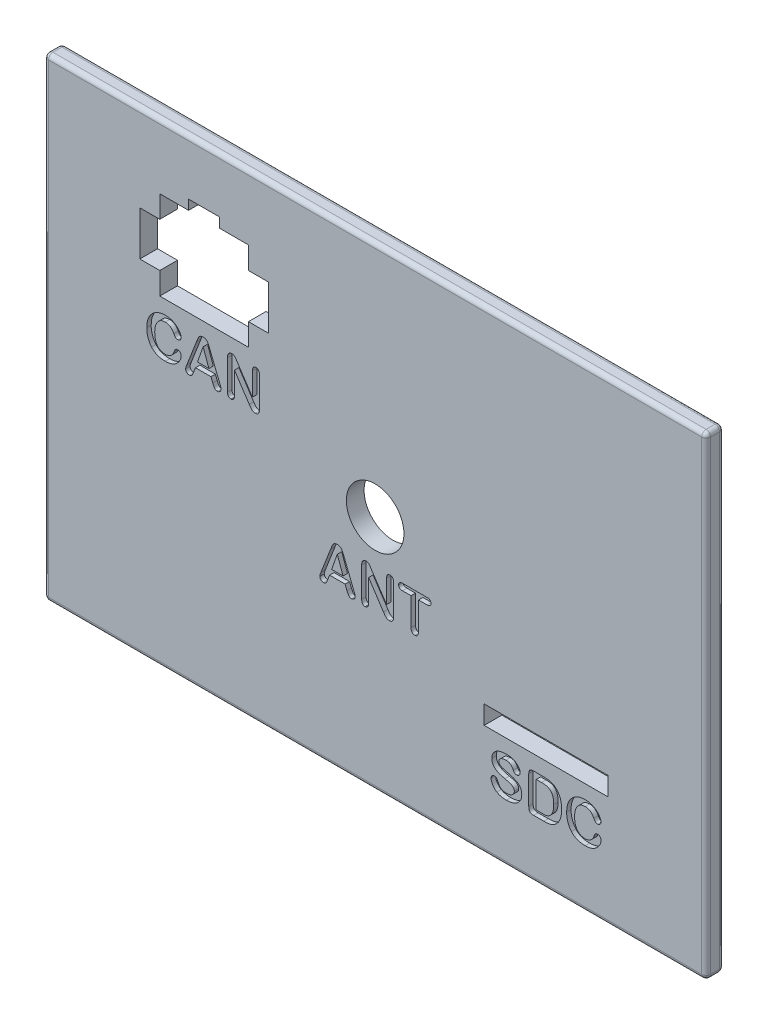
from build123d import *

# Parameters (mm, degrees)
SKETCH1_W           = 74.7
SKETCH1_H           = 53.5
BOSS_EXTRUDE1_DEPTH = 2
SKETCH5_W           = 14
SKETCH5_H           = 2.1
SKETCH5_R           = 3.25
CUT_EXTRUDE1_DEPTH  = 46.984616993
FILLET1_R           = 0.5
CUT_EXTRUDE2_DEPTH  = 0.5


with BuildPart() as part:
    # Sketch1 → Boss-Extrude1 (new body)
    with BuildSketch(Plane.XY):
        Rectangle(SKETCH1_W, SKETCH1_H)
    extrude(amount=BOSS_EXTRUDE1_DEPTH)

    # Sketch5 → Cut-Extrude1 (cut, through all)
    with BuildSketch(Plane.XY.offset(2)):
        Polygon((-24.3, 9.45), (-14.3, 9.45), (-14.3, 11.95), (-12.05, 11.95), (-12.05, 16.95), (-14.3, 16.95), (-14.3, 19.45), (-17.55, 19.45), (-17.55, 20.55), (-21.05, 20.55), (-21.05, 19.45), (-24.3, 19.45), (-24.3, 16.95), (-26.55, 16.95), (-26.55, 11.95), (-24.3, 11.95), align=None)
        with Locations((19.3, -13.15)):
            Rectangle(SKETCH5_W, SKETCH5_H)
        Circle(SKETCH5_R)
    extrude(amount=-CUT_EXTRUDE1_DEPTH, mode=Mode.SUBTRACT)

    # Fillet1
    fillet1_edges = [part.edges().sort_by_distance(p)[0] for p in [
        (-37.35, 0, 2),
        (0, -26.75, 2),
        (37.35, 0, 2),
        (0, -26.75, 0),
        (-37.35, 0, 0),
        (0, 26.75, 0),
        (37.35, 0, 0),
        (37.35, -26.75, 1),
        (-37.35, -26.75, 1),
        (-37.35, 26.75, 1),
        (37.35, 26.75, 1),
        (0, 26.75, 2),
    ]]
    fillet(fillet1_edges, radius=FILLET1_R)

    # Sketch6 → Cut-Extrude2 (cut)
    # profile 1 of 9: a face of its own
    with BuildSketch(Plane.XY.offset(2)):
        with BuildLine():
            add(Edge.make_bspline(
                [(-21.884863281, 4.829003906), (-21.886057094, 4.794056647), (-21.888521988, 4.721900184), (-21.909251985, 4.612138484), (-21.940999769, 4.4979383), (-21.986141413, 4.380626314), (-22.04347078, 4.260966163), (-22.117789191, 4.142674879), (-22.205741004, 4.024922581), (-22.308131844, 3.909172422), (-22.425142436, 3.799296943), (-22.558880555, 3.70001768), (-22.7074398, 3.611752476), (-22.870628097, 3.534000083), (-23.04834912, 3.470069416), (-23.241628866, 3.426127215), (-23.448496536, 3.398183798), (-23.591311619, 3.395254315), (-23.664648437, 3.39375)],
                knots=[0, 0, 0, 0, 0.663733519, 1.370426865, 2.116139696, 2.914458905, 3.756161797, 4.633801399, 5.564768272, 6.546895284, 7.567232022, 8.609557965, 9.705783212, 10.846455846, 12.040496113, 13.287086875, 14.606894913, 16, 16, 16, 16], degree=3))
            add(Edge.make_bspline(
                [(-23.664648437, 3.39375), (-23.720633584, 3.394220413), (-23.830111703, 3.395140298), (-23.990512826, 3.408316902), (-24.143458118, 3.427047622), (-24.288935404, 3.4539833), (-24.427215986, 3.490363338), (-24.558752709, 3.535097578), (-24.684584073, 3.587752841), (-24.803684244, 3.650392758), (-24.917215534, 3.723378242), (-25.02589883, 3.805960696), (-25.130850828, 3.898540442), (-25.194819294, 3.967678912), (-25.22734375, 4.002832031)],
                knots=[0, 0, 0, 0, 1.162398207, 2.273052359, 3.340187725, 4.361698781, 5.343118899, 6.307107414, 7.245071305, 8.173155143, 9.098082292, 10.044846171, 11.00591152, 12, 12, 12, 12], degree=3))
            add(Edge.make_bspline(
                [(-25.22734375, 4.002832031), (-25.255589202, 4.037961763), (-25.312203364, 4.108374526), (-25.390111059, 4.220431962), (-25.459570948, 4.339625624), (-25.525586162, 4.463165003), (-25.581949018, 4.59346772), (-25.632224116, 4.727698528), (-25.674782061, 4.8664731), (-25.708473465, 5.009876978), (-25.736424734, 5.157270667), (-25.753765904, 5.309472076), (-25.767342079, 5.465382026), (-25.768277671, 5.571062029), (-25.76875, 5.624414063)],
                knots=[0, 0, 0, 0, 0.929575355, 1.863207229, 2.811429804, 3.773642551, 4.750392879, 5.73698116, 6.729013264, 7.741753443, 8.774044155, 9.821085133, 10.899985467, 12, 12, 12, 12], degree=3))
            add(Edge.make_bspline(
                [(-25.76875, 5.624414063), (-25.767022042, 5.710346034), (-25.763650091, 5.878034327), (-25.733677911, 6.122292947), (-25.687204443, 6.353287685), (-25.61920174, 6.569753674), (-25.533543274, 6.772089928), (-25.432122567, 6.960042108), (-25.31205981, 7.131944178), (-25.17690159, 7.288413214), (-25.027071962, 7.428456039), (-24.864894257, 7.551237913), (-24.69032629, 7.655594309), (-24.50468213, 7.741721519), (-24.309794446, 7.808757789), (-24.108202317, 7.858759114), (-23.900190329, 7.888201346), (-23.759368931, 7.891890331), (-23.688378906, 7.89375)],
                knots=[0, 0, 0, 0, 1.192086909, 2.32624733, 3.409866705, 4.457877143, 5.469000883, 6.455088314, 7.416011801, 8.372962001, 9.319325461, 10.256879636, 11.190511563, 12.136385829, 13.091719595, 14.046248446, 15.015086683, 16, 16, 16, 16], degree=3))
            add(Edge.make_bspline(
                [(-23.688378906, 7.89375), (-23.645003752, 7.893007028), (-23.559318242, 7.891539323), (-23.432515128, 7.881915766), (-23.309329029, 7.865069093), (-23.18962754, 7.842203116), (-23.073486544, 7.81360166), (-22.961155614, 7.777107858), (-22.852492222, 7.73434287), (-22.748142159, 7.684754146), (-22.648249581, 7.631631766), (-22.554325717, 7.574310691), (-22.465908852, 7.51471716), (-22.383987666, 7.450989428), (-22.307560025, 7.384790368), (-22.238025477, 7.314607981), (-22.173223803, 7.242787511), (-22.115985293, 7.167221169), (-22.064054215, 7.091577958), (-22.020088471, 7.015425459), (-21.982453281, 6.940812009), (-21.949781653, 6.867702097), (-21.926381176, 6.794765325), (-21.909665685, 6.723015211), (-21.898331455, 6.652506058), (-21.896964752, 6.605608004), (-21.896289062, 6.582421875)],
                knots=[0, 0, 0, 0, 1.284700242, 2.537862918, 3.763812693, 4.965289083, 6.145935712, 7.303948861, 8.460888676, 9.602102237, 10.724019168, 11.810373379, 12.859709494, 13.88027226, 14.88267171, 15.852117704, 16.804758353, 17.745428632, 18.657571087, 19.520770973, 20.347343408, 21.132381758, 21.889741149, 22.611674871, 23.313620019, 24, 24, 24, 24], degree=3))
            add(Edge.make_bspline(
                [(-21.896289062, 6.582421875), (-21.897767281, 6.557996548), (-21.90068221, 6.50983176), (-21.920243348, 6.4393334), (-21.955923928, 6.37484715), (-22.001706231, 6.315572385), (-22.057244589, 6.265686386), (-22.119918757, 6.228859237), (-22.188509753, 6.205350026), (-22.23652906, 6.203036268), (-22.261035156, 6.201855469)],
                knots=[0, 0, 0, 0, 1.005202555, 1.982178884, 2.979908251, 4.019228851, 5.052378826, 6.030321538, 6.994797445, 8, 8, 8, 8], degree=3))
            add(Edge.make_bspline(
                [(-22.261035156, 6.201855469), (-22.287468978, 6.20285214), (-22.337584401, 6.20474171), (-22.407805062, 6.21909527), (-22.467501456, 6.244770194), (-22.518128566, 6.282271408), (-22.561601116, 6.334044744), (-22.606992997, 6.397456194), (-22.65543894, 6.475270009), (-22.686481302, 6.533007997), (-22.703125, 6.563964844)],
                knots=[0, 0, 0, 0, 1.03602979, 1.964190893, 2.792215287, 3.564084538, 4.410155262, 5.430272824, 6.62221301, 8, 8, 8, 8], degree=3))
            add(Edge.make_bspline(
                [(-22.703125, 6.563964844), (-22.731926771, 6.615897548), (-22.787491163, 6.716086151), (-22.885493382, 6.850529495), (-22.991253205, 6.964140596), (-23.105268161, 7.057979495), (-23.231006748, 7.130638726), (-23.36941063, 7.183014306), (-23.521893789, 7.212686063), (-23.627606269, 7.216684209), (-23.682226562, 7.21875)],
                knots=[0, 0, 0, 0, 1.14083101, 2.200891824, 3.189077095, 4.117958574, 5.028926365, 5.968284059, 6.950238216, 8, 8, 8, 8], degree=3))
            add(Edge.make_bspline(
                [(-23.682226562, 7.21875), (-23.726263025, 7.217784627), (-23.812774236, 7.215888118), (-23.938779062, 7.194561528), (-24.058251271, 7.162819439), (-24.170408387, 7.116003457), (-24.276195656, 7.057453795), (-24.374553512, 6.984422619), (-24.465486212, 6.898163539), (-24.549908855, 6.799837239), (-24.625411416, 6.689031813), (-24.690338774, 6.566759379), (-24.746267554, 6.434266868), (-24.790199163, 6.28999193), (-24.827002622, 6.135190356), (-24.850399539, 5.968639636), (-24.865797119, 5.791697286), (-24.867747887, 5.670152559), (-24.86875, 5.607714844)],
                knots=[0, 0, 0, 0, 0.93671651, 1.840213212, 2.713397844, 3.56368846, 4.421020421, 5.281885359, 6.164466969, 7.084649485, 8.036264718, 9.013062724, 10.027939462, 11.093339593, 12.220621858, 13.412469407, 14.670781518, 16, 16, 16, 16], degree=3))
            add(Edge.make_bspline(
                [(-24.86875, 5.607714844), (-24.868104662, 5.565522112), (-24.866844688, 5.483144039), (-24.861059512, 5.361998662), (-24.849643473, 5.246458871), (-24.833518903, 5.136302738), (-24.814810002, 5.031353093), (-24.790138351, 4.932207533), (-24.760842839, 4.838398858), (-24.728073625, 4.749746011), (-24.689373356, 4.667052477), (-24.649775391, 4.588508883), (-24.604901548, 4.516060592), (-24.554911648, 4.450321624), (-24.50339892, 4.388050164), (-24.447156278, 4.331915422), (-24.386975807, 4.281590958), (-24.302463413, 4.221690769), (-24.187976905, 4.159910726), (-24.039275347, 4.106820458), (-23.879328455, 4.074371681), (-23.76880766, 4.07065612), (-23.712109375, 4.06875)],
                knots=[0, 0, 0, 0, 1.161576005, 2.267888061, 3.337585273, 4.356077319, 5.33204537, 6.270922222, 7.166254778, 8.036538097, 8.870177389, 9.678142996, 10.45692397, 11.2117863, 11.950096439, 12.68003429, 13.395618977, 14.107193223, 15.528992878, 16.960094082, 18.440497528, 20, 20, 20, 20], degree=3))
            add(Edge.make_bspline(
                [(-23.712109375, 4.06875), (-23.681022975, 4.06907424), (-23.619861844, 4.069712167), (-23.530373804, 4.080132678), (-23.444208213, 4.094702677), (-23.362052277, 4.115977523), (-23.282874008, 4.141955875), (-23.208333352, 4.175938566), (-23.136646175, 4.214501763), (-23.068811019, 4.259293398), (-23.005467551, 4.310752319), (-22.945641852, 4.367230051), (-22.888831564, 4.428452804), (-22.838242134, 4.496953233), (-22.790359926, 4.570143188), (-22.746662298, 4.649176094), (-22.706818005, 4.733671793), (-22.684555949, 4.792801404), (-22.673242187, 4.822851563)],
                knots=[0, 0, 0, 0, 1.080453892, 2.125745732, 3.129130718, 4.117609764, 5.07455133, 6.023212249, 6.962414916, 7.903439618, 8.845456672, 9.796903999, 10.763291339, 11.745501622, 12.754406698, 13.803416246, 14.883677954, 16, 16, 16, 16], degree=3))
            add(Edge.make_bspline(
                [(-22.673242187, 4.822851563), (-22.663703569, 4.850842061), (-22.645276697, 4.904914599), (-22.611863559, 4.980382063), (-22.575565365, 5.047738311), (-22.536835856, 5.108359409), (-22.487569466, 5.158842677), (-22.424857479, 5.194819144), (-22.349517365, 5.214701973), (-22.295725594, 5.217091606), (-22.2671875, 5.218359375)],
                knots=[0, 0, 0, 0, 1.148264852, 2.218238262, 3.200956292, 4.119438462, 5.004604087, 5.912235567, 6.892380428, 8, 8, 8, 8], degree=3))
            add(Edge.make_bspline(
                [(-22.2671875, 5.218359375), (-22.241821072, 5.217098618), (-22.191924892, 5.214618688), (-22.120426214, 5.192157659), (-22.053705739, 5.157815352), (-21.995969044, 5.10810378), (-21.946221447, 5.050011615), (-21.910495, 4.982532384), (-21.888548228, 4.90799325), (-21.886114194, 4.855818083), (-21.884863281, 4.829003906)],
                knots=[0, 0, 0, 0, 1.000050397, 1.967115494, 2.935635085, 3.946684534, 4.957733984, 5.941906876, 6.942292355, 8, 8, 8, 8], degree=3))
        make_face()
    # profile 2 of 9: a face of its own
    with BuildSketch(Plane.XY.offset(2)):
        with BuildLine():
            Line((-18.318261719, 3.937792969), (-18.523925781, 4.4625))
            Line((-18.523925781, 4.4625), (-20.273828125, 4.4625))
            Line((-20.273828125, 4.4625), (-20.479492187, 3.926367188))
            add(Edge.make_bspline(
                [(-20.479492187, 3.926367188), (-20.498376972, 3.878135809), (-20.532989727, 3.789735492), (-20.586637938, 3.6711749), (-20.635266147, 3.577743801), (-20.680358927, 3.505181662), (-20.732955909, 3.451682631), (-20.79890901, 3.417407614), (-20.877623411, 3.397221147), (-20.934337272, 3.394959014), (-20.964648437, 3.39375)],
                knots=[0, 0, 0, 0, 1.589179946, 2.912709847, 3.990397165, 4.820646782, 5.526248733, 6.26234321, 7.071295771, 8, 8, 8, 8], degree=3))
            add(Edge.make_bspline(
                [(-20.964648437, 3.39375), (-20.991484232, 3.395262301), (-21.0444056, 3.398244626), (-21.120899626, 3.422454537), (-21.19231069, 3.461062984), (-21.257095381, 3.513249339), (-21.311808059, 3.574874809), (-21.351455872, 3.643388569), (-21.37688319, 3.716017689), (-21.379788265, 3.766495709), (-21.38125, 3.791894531)],
                knots=[0, 0, 0, 0, 1.012468346, 1.996632184, 3.002236258, 4.065667855, 5.124941345, 6.097262832, 7.042607408, 8, 8, 8, 8], degree=3))
            add(Edge.make_bspline(
                [(-21.38125, 3.791894531), (-21.379895267, 3.822194033), (-21.377112393, 3.884434857), (-21.357317278, 3.962920807), (-21.333550876, 4.030778076), (-21.311591688, 4.092320019), (-21.285509161, 4.163445828), (-21.265379663, 4.213532328), (-21.2546875, 4.240136719)],
                knots=[0, 0, 0, 0, 1.162779838, 2.388566498, 3.08974091, 3.926345762, 4.898539362, 6, 6, 6, 6], degree=3))
            Line((-21.2546875, 4.240136719), (-20.153417969, 7.065820313))
            add(Edge.make_bspline(
                [(-20.153417969, 7.065820313), (-20.145274887, 7.08723032), (-20.128293111, 7.131879261), (-20.100389852, 7.201530891), (-20.072066956, 7.277787601), (-20.040915906, 7.357839328), (-20.009217195, 7.43801458), (-19.973527337, 7.512291673), (-19.939090224, 7.580482934), (-19.901702654, 7.641202668), (-19.860972235, 7.696029302), (-19.81429663, 7.744454058), (-19.761399025, 7.78694623), (-19.703485949, 7.825357385), (-19.638209904, 7.856168949), (-19.565736114, 7.878258938), (-19.48622394, 7.891450714), (-19.430716207, 7.892965214), (-19.401953125, 7.89375)],
                knots=[0, 0, 0, 0, 0.906149852, 1.889706515, 2.96811083, 4.12389095, 5.288239382, 6.376994434, 7.382631969, 8.308939681, 9.194397083, 10.07962691, 10.961131357, 11.874074475, 12.822804478, 13.805267996, 14.862730428, 16, 16, 16, 16], degree=3))
            add(Edge.make_bspline(
                [(-19.401953125, 7.89375), (-19.37289357, 7.892973189), (-19.316796718, 7.891473626), (-19.236469415, 7.87816451), (-19.163448352, 7.856626271), (-19.098749133, 7.824974429), (-19.040419921, 7.787680483), (-18.987342008, 7.745871934), (-18.941172971, 7.697547658), (-18.887689333, 7.62667168), (-18.830149592, 7.530619993), (-18.782010251, 7.426959881), (-18.747104715, 7.335729029), (-18.714456311, 7.257551118), (-18.680876221, 7.167801546), (-18.65695226, 7.104484207), (-18.644335937, 7.07109375)],
                knots=[0, 0, 0, 0, 1.005463131, 1.940955953, 2.810500616, 3.631666672, 4.42517864, 5.204561669, 5.964968357, 6.731842121, 8.274852444, 9.831306624, 10.68267648, 11.656482744, 12.764143998, 14, 14, 14, 14], degree=3))
            Line((-18.644335937, 7.07109375), (-17.519335937, 4.263867188))
            add(Edge.make_bspline(
                [(-17.519335937, 4.263867188), (-17.509051891, 4.238101267), (-17.489248349, 4.188484952), (-17.46123927, 4.116856335), (-17.440356629, 4.049673329), (-17.419584672, 3.989107225), (-17.406322542, 3.932986755), (-17.39531352, 3.883018021), (-17.388509812, 3.838374046), (-17.38782357, 3.810371487), (-17.3875, 3.797167969)],
                knots=[0, 0, 0, 0, 1.36622511, 2.630880465, 3.785062113, 4.829837655, 5.781525877, 6.621841003, 7.350182692, 8, 8, 8, 8], degree=3))
            add(Edge.make_bspline(
                [(-17.3875, 3.797167969), (-17.389116357, 3.772400862), (-17.392360355, 3.722693739), (-17.416126348, 3.649748921), (-17.457387743, 3.58148613), (-17.510848053, 3.517478192), (-17.575174711, 3.462590611), (-17.648793647, 3.422702714), (-17.728718026, 3.398117503), (-17.784592612, 3.395218312), (-17.812890625, 3.39375)],
                knots=[0, 0, 0, 0, 0.918533131, 1.843478885, 2.81316186, 3.862812883, 4.927781559, 5.930017069, 6.951644948, 8, 8, 8, 8], degree=3))
            add(Edge.make_bspline(
                [(-17.812890625, 3.39375), (-17.845034362, 3.395162388), (-17.905595251, 3.397823419), (-17.989339934, 3.424845041), (-18.057967588, 3.468994625), (-18.106479273, 3.516208089), (-18.139853484, 3.563293528), (-18.166111354, 3.606545489), (-18.193242823, 3.657674666), (-18.229373196, 3.734156918), (-18.270040922, 3.828886456), (-18.302966904, 3.903249679), (-18.318261719, 3.937792969)],
                knots=[0, 0, 0, 0, 1.202315025, 2.265239587, 3.252603888, 4.239051274, 4.781746036, 5.412840692, 6.135219166, 6.950797606, 8.583580985, 10, 10, 10, 10], degree=3))
        make_face()
        Polygon((-20.0453125, 5.1375), (-18.75859375, 5.1375), (-19.408105469, 6.9375), align=None, mode=Mode.SUBTRACT)
    # profile 3 of 9: a face of its own
    with BuildSketch(Plane.XY.offset(2)):
        with BuildLine():
            Line((-15.554101562, 7.365527344), (-13.84375, 4.8))
            Line((-13.84375, 4.8), (-13.84375, 7.389257813))
            add(Edge.make_bspline(
                [(-13.84375, 7.389257813), (-13.84242962, 7.428890836), (-13.839956489, 7.503125255), (-13.821168096, 7.60720892), (-13.788246847, 7.695501131), (-13.741595069, 7.768006788), (-13.683592782, 7.824715656), (-13.615107199, 7.865002193), (-13.537485329, 7.889691024), (-13.482706336, 7.892366972), (-13.454394531, 7.89375)],
                knots=[0, 0, 0, 0, 1.319117216, 2.470765316, 3.505116792, 4.43580569, 5.318756254, 6.18027265, 7.059497782, 8, 8, 8, 8], degree=3))
            add(Edge.make_bspline(
                [(-13.454394531, 7.89375), (-13.425221306, 7.892341002), (-13.3687539, 7.889613758), (-13.288898563, 7.86542748), (-13.219104722, 7.824722793), (-13.160184578, 7.768090007), (-13.112682383, 7.695581862), (-13.07860514, 7.607397588), (-13.060118507, 7.503099712), (-13.057596483, 7.428881946), (-13.05625, 7.389257813)],
                knots=[0, 0, 0, 0, 0.959871134, 1.857917088, 2.719075999, 3.600089629, 4.526699118, 5.554128738, 6.694173474, 8, 8, 8, 8], degree=3))
            Line((-13.05625, 7.389257813), (-13.05625, 3.966796875))
            add(Edge.make_bspline(
                [(-13.05625, 3.966796875), (-13.05733574, 3.921872847), (-13.059373547, 3.837555646), (-13.081084085, 3.719658122), (-13.117697373, 3.61930552), (-13.168924925, 3.536042144), (-13.236347834, 3.470717175), (-13.319699284, 3.425816133), (-13.41688116, 3.39777233), (-13.486414404, 3.395135479), (-13.522949219, 3.39375)],
                knots=[0, 0, 0, 0, 1.276164049, 2.395212213, 3.391561633, 4.297456637, 5.151673506, 6.027862746, 6.963780962, 8, 8, 8, 8], degree=3))
            add(Edge.make_bspline(
                [(-13.522949219, 3.39375), (-13.559989822, 3.395487935), (-13.631431233, 3.398839948), (-13.734350002, 3.423312633), (-13.827926122, 3.468969046), (-13.912006085, 3.534985389), (-13.990718291, 3.61505205), (-14.062766795, 3.707921797), (-14.130646785, 3.808537853), (-14.177105113, 3.876299164), (-14.200585937, 3.910546875)],
                knots=[0, 0, 0, 0, 0.990229924, 1.909888509, 2.806876858, 3.75171819, 4.754420985, 5.802993103, 6.889595585, 8, 8, 8, 8], degree=3))
            Line((-14.200585937, 3.910546875), (-15.86875, 6.43125))
            Line((-15.86875, 6.43125), (-15.86875, 3.895605469))
            add(Edge.make_bspline(
                [(-15.86875, 3.895605469), (-15.870067323, 3.856855087), (-15.872562669, 3.783451999), (-15.891830283, 3.680234626), (-15.927275726, 3.592104151), (-15.975975128, 3.519628949), (-16.035778071, 3.463238413), (-16.104145754, 3.422641199), (-16.180864971, 3.397882516), (-16.234775039, 3.395153489), (-16.2625, 3.39375)],
                knots=[0, 0, 0, 0, 1.293064309, 2.449392962, 3.484384031, 4.441729672, 5.340986808, 6.204611779, 7.076664708, 8, 8, 8, 8], degree=3))
            add(Edge.make_bspline(
                [(-16.2625, 3.39375), (-16.290814098, 3.39510096), (-16.345966343, 3.397732457), (-16.424035108, 3.423166466), (-16.492697535, 3.465140689), (-16.552659609, 3.521849576), (-16.599315791, 3.595691823), (-16.632640241, 3.68382643), (-16.652655403, 3.786323802), (-16.655004833, 3.859473689), (-16.65625, 3.898242188)],
                knots=[0, 0, 0, 0, 0.938889884, 1.828837584, 2.693878765, 3.596100726, 4.546832571, 5.570326044, 6.712304089, 8, 8, 8, 8], degree=3))
            Line((-16.65625, 3.898242188), (-16.65625, 7.255664063))
            add(Edge.make_bspline(
                [(-16.65625, 7.255664063), (-16.655920262, 7.28938752), (-16.655296758, 7.353155402), (-16.646074601, 7.442944965), (-16.633472534, 7.52196837), (-16.617850789, 7.56928395), (-16.610546875, 7.59140625)],
                knots=[0, 0, 0, 0, 1.18793306, 2.246269525, 3.180047019, 4, 4, 4, 4], degree=3))
            add(Edge.make_bspline(
                [(-16.610546875, 7.59140625), (-16.600745977, 7.612932192), (-16.581179031, 7.655907537), (-16.538273306, 7.712851537), (-16.489302623, 7.765923472), (-16.430203606, 7.809646719), (-16.366437327, 7.846807097), (-16.298809731, 7.874271752), (-16.228129168, 7.890759138), (-16.180261375, 7.892748194), (-16.156152344, 7.89375)],
                knots=[0, 0, 0, 0, 0.980600708, 1.957714689, 2.948627098, 3.97434472, 5.000279326, 6.011426356, 6.998437519, 8, 8, 8, 8], degree=3))
            add(Edge.make_bspline(
                [(-16.156152344, 7.89375), (-16.120126443, 7.89231673), (-16.052571298, 7.889629088), (-15.959421113, 7.858516988), (-15.880122753, 7.812909429), (-15.811549028, 7.750656812), (-15.746710783, 7.673720691), (-15.686617579, 7.578870417), (-15.621543661, 7.474669311), (-15.576925173, 7.402462934), (-15.554101562, 7.365527344)],
                knots=[0, 0, 0, 0, 1.01695463, 1.906975685, 2.751376853, 3.592506721, 4.517315556, 5.594915983, 6.76973195, 8, 8, 8, 8], degree=3))
        make_face()
    # profile 4 of 9: a face of its own
    with BuildSketch(Plane.XY.offset(2)):
        with BuildLine():
            add(Edge.make_bspline(
                [(16.54375, -18.852636719), (16.543026039, -18.885765688), (16.541594266, -18.951284656), (16.531661865, -19.04818485), (16.515868159, -19.142433765), (16.494115245, -19.234243426), (16.464847908, -19.323134166), (16.429347787, -19.409633511), (16.388579811, -19.494153648), (16.339541724, -19.575042423), (16.285764614, -19.652986842), (16.225161779, -19.726425771), (16.159662525, -19.796085796), (16.086711834, -19.860292634), (16.008696153, -19.920861359), (15.924815571, -19.977407512), (15.834884253, -20.029227799), (15.7392549, -20.076644251), (15.638169145, -20.118673835), (15.532475157, -20.155418953), (15.422439469, -20.187841465), (15.307230683, -20.211174908), (15.188120631, -20.232365495), (15.063906452, -20.245693245), (14.935203016, -20.255040513), (14.847771854, -20.255843527), (14.803515625, -20.25625)],
                knots=[0, 0, 0, 0, 0.94904565, 1.876922008, 2.787632434, 3.685409961, 4.577243309, 5.465673456, 6.362823001, 7.262481841, 8.172882791, 9.073480814, 9.987781212, 10.909257821, 11.854472834, 12.815908446, 13.804938933, 14.825933836, 15.871877953, 16.938992789, 18.030809531, 19.155177508, 20.304610591, 21.495671913, 22.732349945, 24, 24, 24, 24], degree=3))
            add(Edge.make_bspline(
                [(14.803515625, -20.25625), (14.750766685, -20.255256484), (14.64719682, -20.253305765), (14.495362543, -20.242436973), (14.350823679, -20.221669065), (14.212913628, -20.194992038), (14.082153285, -20.159103973), (13.958802566, -20.114634783), (13.841603313, -20.064557502), (13.768972426, -20.022882361), (13.733007813, -20.002246094)],
                knots=[0, 0, 0, 0, 1.136969792, 2.232382444, 3.278022597, 4.282276305, 5.258039159, 6.196692155, 7.1070566, 8, 8, 8, 8], degree=3))
            add(Edge.make_bspline(
                [(13.733007813, -20.002246094), (13.686396798, -19.9715052), (13.593654064, -19.910339516), (13.470603361, -19.79724056), (13.358627214, -19.672362986), (13.263644039, -19.533938687), (13.18584425, -19.389867941), (13.128593192, -19.244934976), (13.093333962, -19.101287054), (13.088499244, -19.005747669), (13.086132813, -18.958984375)],
                knots=[0, 0, 0, 0, 1.048405233, 2.086029851, 3.131870059, 4.19698972, 5.234628962, 6.204463721, 7.121145791, 8, 8, 8, 8], degree=3))
            add(Edge.make_bspline(
                [(13.086132813, -18.958984375), (13.087469242, -18.932772928), (13.090079374, -18.881580333), (13.111027311, -18.808052378), (13.145318931, -18.740862758), (13.191450221, -18.680281661), (13.249259645, -18.63030003), (13.315656216, -18.59356742), (13.389601975, -18.570366943), (13.441621235, -18.568140678), (13.468457031, -18.566992187)],
                knots=[0, 0, 0, 0, 1.029346977, 2.010378973, 2.978887221, 3.98112847, 4.985683985, 5.960201932, 6.947705008, 8, 8, 8, 8], degree=3))
            add(Edge.make_bspline(
                [(13.468457031, -18.566992187), (13.49026134, -18.567838963), (13.532518724, -18.569480039), (13.593181962, -18.587160139), (13.648369794, -18.615581342), (13.69830842, -18.655645039), (13.744371718, -18.705292555), (13.785549617, -18.76653293), (13.824491751, -18.83748542), (13.845223411, -18.890157302), (13.856054688, -18.917675781)],
                knots=[0, 0, 0, 0, 0.932433643, 1.807083439, 2.683354794, 3.577798377, 4.537574086, 5.575745438, 6.73344572, 8, 8, 8, 8], degree=3))
            add(Edge.make_bspline(
                [(13.856054688, -18.917675781), (13.870451683, -18.950890158), (13.898239832, -19.014998398), (13.942634936, -19.106247), (13.990804768, -19.187704988), (14.038626665, -19.263357121), (14.094196721, -19.331191207), (14.160251537, -19.390865843), (14.235420285, -19.445786461), (14.321320061, -19.494595383), (14.419581039, -19.534912627), (14.532352965, -19.560775281), (14.657891832, -19.57918846), (14.746601778, -19.580542349), (14.79296875, -19.58125)],
                knots=[0, 0, 0, 0, 1.049400523, 2.025484958, 2.938775158, 3.791458515, 4.617854192, 5.471340711, 6.364831691, 7.311813007, 8.329001391, 9.430967745, 10.65721654, 12, 12, 12, 12], degree=3))
            add(Edge.make_bspline(
                [(14.79296875, -19.58125), (14.825805655, -19.580853487), (14.89013894, -19.580076647), (14.984030642, -19.570795329), (15.073470102, -19.557300179), (15.157497651, -19.536533127), (15.23771139, -19.512667474), (15.312299015, -19.480387586), (15.382800214, -19.443802566), (15.447785705, -19.401626627), (15.506642821, -19.355143228), (15.55862715, -19.305479136), (15.60220887, -19.252252524), (15.637459277, -19.196284198), (15.666414821, -19.138306455), (15.685152699, -19.076743371), (15.698614641, -19.012890327), (15.69953257, -18.969019636), (15.7, -18.946679687)],
                knots=[0, 0, 0, 0, 1.280104897, 2.507951138, 3.676307556, 4.80418709, 5.881088807, 6.935759984, 7.968101261, 8.975871649, 9.951925376, 10.889226907, 11.77430911, 12.626938706, 13.464975202, 14.292430499, 15.130466995, 16, 16, 16, 16], degree=3))
            add(Edge.make_bspline(
                [(15.7, -18.946679687), (15.69840427, -18.912223358), (15.695328256, -18.845803495), (15.669084382, -18.751592134), (15.626286979, -18.667322364), (15.564780414, -18.59524286), (15.491072662, -18.532149835), (15.407262349, -18.476527443), (15.312973982, -18.430170737), (15.207945967, -18.390276793), (15.088661481, -18.35502233), (14.953593489, -18.316622383), (14.799648831, -18.279739489), (14.691036912, -18.254878439), (14.633886719, -18.241796875)],
                knots=[0, 0, 0, 0, 0.889216893, 1.714102054, 2.506617733, 3.313297162, 4.145346194, 5.008548814, 5.905982136, 6.85524107, 7.90915739, 9.119934543, 10.484546625, 12, 12, 12, 12], degree=3))
            add(Edge.make_bspline(
                [(14.633886719, -18.241796875), (14.55900825, -18.223405117), (14.414904046, -18.188010033), (14.209828551, -18.126529193), (14.023874182, -18.060515482), (13.854881791, -17.991188874), (13.703716761, -17.911042577), (13.569071669, -17.818252499), (13.451888919, -17.711193142), (13.36664023, -17.611811501), (13.309367018, -17.525044638), (13.27108692, -17.456277864), (13.239590771, -17.38317552), (13.214211012, -17.306305662), (13.194019855, -17.226103089), (13.17890522, -17.142170572), (13.170031995, -17.054295457), (13.16918224, -16.994356173), (13.16875, -16.963867188)],
                knots=[0, 0, 0, 0, 1.736501148, 3.341910126, 4.819600125, 6.179978285, 7.452384316, 8.666026066, 9.852526874, 11.018500134, 11.604160195, 12.191898388, 12.788898658, 13.394048862, 14.013423104, 14.650267458, 15.313438986, 16, 16, 16, 16], degree=3))
            add(Edge.make_bspline(
                [(13.16875, -16.963867188), (13.169063861, -16.934533709), (13.16968398, -16.876577261), (13.180455012, -16.790962042), (13.194303153, -16.707494185), (13.21728209, -16.627053144), (13.244109383, -16.548683821), (13.277494159, -16.47257909), (13.31844279, -16.399949349), (13.363795036, -16.329218433), (13.416026242, -16.262586528), (13.473290385, -16.198844383), (13.536527183, -16.139214993), (13.605234098, -16.084040116), (13.6786076, -16.032402283), (13.758241129, -15.985929259), (13.843299906, -15.943322661), (13.964662009, -15.889277663), (14.129216893, -15.835501694), (14.340524369, -15.788778755), (14.568448797, -15.761856705), (14.725808056, -15.758158751), (14.80703125, -15.75625)],
                knots=[0, 0, 0, 0, 0.769447055, 1.520256708, 2.262508943, 2.988321943, 3.713156319, 4.436274914, 5.166110871, 5.89994773, 6.639925254, 7.385953261, 8.147635144, 8.918771606, 9.697541001, 10.500837489, 11.336648996, 12.194084557, 13.986552036, 15.869357873, 17.867910982, 20, 20, 20, 20], degree=3))
            add(Edge.make_bspline(
                [(14.80703125, -15.75625), (14.871825226, -15.757337098), (14.997006457, -15.75943736), (15.178023115, -15.77815889), (15.345442452, -15.808271182), (15.499306038, -15.851275067), (15.639258425, -15.906009618), (15.768697756, -15.965324949), (15.883989382, -16.036453977), (15.987106998, -16.113747495), (16.077198718, -16.195862573), (16.154550324, -16.280953058), (16.219323253, -16.367821066), (16.270150403, -16.457123523), (16.310162762, -16.545982311), (16.33851091, -16.634386915), (16.356219773, -16.722041749), (16.358201759, -16.780390106), (16.359179688, -16.809179687)],
                knots=[0, 0, 0, 0, 1.501690988, 2.90125006, 4.213360721, 5.441058994, 6.597662568, 7.694391675, 8.736870916, 9.731158549, 10.678212085, 11.558107852, 12.393499291, 13.184506524, 13.935459515, 14.648542639, 15.3331793, 16, 16, 16, 16], degree=3))
            add(Edge.make_bspline(
                [(16.359179688, -16.809179687), (16.357806059, -16.834803746), (16.355093432, -16.885405889), (16.333923053, -16.959193617), (16.298988724, -17.028336654), (16.251962716, -17.091839197), (16.195172866, -17.146266274), (16.12916676, -17.185979749), (16.056253277, -17.211089136), (16.004892062, -17.213831337), (15.978613281, -17.215234375)],
                knots=[0, 0, 0, 0, 0.996822281, 1.968514991, 2.963507279, 3.999520829, 5.032703306, 6.005199511, 6.979367534, 8, 8, 8, 8], degree=3))
            add(Edge.make_bspline(
                [(15.978613281, -17.215234375), (15.955404399, -17.214434349), (15.911552721, -17.212922752), (15.850115492, -17.200636403), (15.797036024, -17.180762207), (15.751632106, -17.150848884), (15.711384097, -17.111039228), (15.671418062, -17.061897231), (15.627845831, -17.004202771), (15.600899436, -16.960602754), (15.586621094, -16.9375)],
                knots=[0, 0, 0, 0, 1.091449335, 2.062222683, 2.935356023, 3.742291246, 4.60049062, 5.589116983, 6.722522559, 8, 8, 8, 8], degree=3))
            add(Edge.make_bspline(
                [(15.586621094, -16.9375), (15.566024604, -16.895186435), (15.526281712, -16.813538371), (15.455749536, -16.701767578), (15.377804554, -16.605701033), (15.308071454, -16.535087615), (15.246569888, -16.486490574), (15.192903846, -16.456835054), (15.133242398, -16.431779433), (15.067539878, -16.41018505), (14.994993547, -16.394898233), (14.916007642, -16.383651865), (14.830594168, -16.37657931), (14.771595926, -16.375538009), (14.741113281, -16.375)],
                knots=[0, 0, 0, 0, 1.547925219, 2.986869477, 4.337480217, 5.612327564, 6.244828973, 6.909713596, 7.622436063, 8.372459485, 9.181850378, 10.058552105, 10.996911345, 12, 12, 12, 12], degree=3))
            add(Edge.make_bspline(
                [(14.741113281, -16.375), (14.685052257, -16.376858863), (14.578066769, -16.380406272), (14.425451998, -16.407004519), (14.290208001, -16.454760888), (14.19094213, -16.509857051), (14.121673037, -16.56047927), (14.078014732, -16.601068906), (14.04002481, -16.642502481), (14.010170442, -16.686934542), (13.986264496, -16.732908023), (13.96789443, -16.780751124), (13.958601042, -16.831086188), (13.957034068, -16.865106267), (13.95625, -16.882128906)],
                knots=[0, 0, 0, 0, 1.954508865, 3.729936959, 5.377867423, 6.932763574, 7.670377485, 8.364471239, 9.008409927, 9.626125187, 10.224705099, 10.812996495, 11.406058616, 12, 12, 12, 12], degree=3))
            add(Edge.make_bspline(
                [(13.95625, -16.882128906), (13.956995321, -16.903011834), (13.958461963, -16.944105255), (13.972938701, -17.003247869), (13.996317467, -17.058036557), (14.028216134, -17.108609665), (14.06909336, -17.154343897), (14.117702999, -17.195338349), (14.170793687, -17.235665591), (14.252513134, -17.281291414), (14.359000224, -17.331148241), (14.473077771, -17.370729764), (14.576013818, -17.39835602), (14.674328714, -17.423483666), (14.793594405, -17.454722045), (14.880522492, -17.475566004), (14.927441406, -17.486816406)],
                knots=[0, 0, 0, 0, 0.710476229, 1.398074961, 2.059979244, 2.732930957, 3.425942516, 4.140543967, 4.897202213, 5.693324271, 7.323324828, 8.898613798, 9.799484583, 10.954336094, 12.356121149, 14, 14, 14, 14], degree=3))
            add(Edge.make_bspline(
                [(14.927441406, -17.486816406), (14.987272888, -17.50120247), (15.104318019, -17.529345158), (15.275230659, -17.57513425), (15.437452066, -17.623050911), (15.590810226, -17.674188835), (15.734716201, -17.7274095), (15.867260364, -17.78769519), (15.989012414, -17.85235352), (16.099999069, -17.923494081), (16.199231159, -18.003344753), (16.288405585, -18.091254967), (16.364093325, -18.190839186), (16.428817646, -18.299719407), (16.481817612, -18.419679046), (16.518074666, -18.552925162), (16.54029833, -18.698663025), (16.54257251, -18.800110685), (16.54375, -18.852636719)],
                knots=[0, 0, 0, 0, 1.267502217, 2.479546844, 3.644246111, 4.751070339, 5.809111578, 6.802976886, 7.747931384, 8.64678748, 9.513844361, 10.367269951, 11.219414442, 12.082556445, 12.971635876, 13.911644553, 14.918722911, 16, 16, 16, 16], degree=3))
        make_face()
    # profile 5 of 9: a face of its own
    with BuildSketch(Plane.XY.offset(2)):
        with BuildLine():
            Line((17.848046875, -15.86875), (19.002050781, -15.86875))
            add(Edge.make_bspline(
                [(19.002050781, -15.86875), (19.074436829, -15.869785622), (19.214098649, -15.871783755), (19.415501679, -15.886322405), (19.60067276, -15.911910653), (19.772002675, -15.946119361), (19.931875265, -15.995934889), (20.083251751, -16.061952151), (20.227012629, -16.146785055), (20.314714315, -16.216039063), (20.359082031, -16.251074219)],
                knots=[0, 0, 0, 0, 1.205081575, 2.325087405, 3.359068892, 4.315642998, 5.23043171, 6.141167618, 7.05962871, 8, 8, 8, 8], degree=3))
            add(Edge.make_bspline(
                [(20.359082031, -16.251074219), (20.386903418, -16.275968058), (20.442520469, -16.325732721), (20.520644909, -16.405572304), (20.593156878, -16.490443888), (20.659810307, -16.580190225), (20.721461308, -16.674394946), (20.777900267, -16.773249871), (20.829213002, -16.876947527), (20.873297082, -16.98638421), (20.914436176, -17.099490381), (20.947927994, -17.217837885), (20.978669412, -17.340106564), (21.001523381, -17.467984018), (21.021402359, -17.600068351), (21.034132233, -17.737103658), (21.042323367, -17.878706694), (21.04326891, -17.974890244), (21.04375, -18.023828125)],
                knots=[0, 0, 0, 0, 0.912368264, 1.823893017, 2.72801767, 3.638923354, 4.554573881, 5.478337415, 6.419915908, 7.380074035, 8.360841029, 9.360254469, 10.385003032, 11.441221399, 12.53397507, 13.649142366, 14.803891193, 16, 16, 16, 16], degree=3))
            add(Edge.make_bspline(
                [(21.04375, -18.023828125), (21.042846141, -18.088004621), (21.041082106, -18.213256133), (21.029053827, -18.397282291), (21.006915477, -18.5723593), (20.977288188, -18.739430287), (20.938820156, -18.898131289), (20.890686337, -19.048665499), (20.832296145, -19.191114761), (20.764526496, -19.325571378), (20.687971971, -19.453343915), (20.600053881, -19.572861924), (20.503855763, -19.687331328), (20.431525594, -19.756494394), (20.395117188, -19.791308594)],
                knots=[0, 0, 0, 0, 1.189908064, 2.322311019, 3.417156475, 4.460275639, 5.466815511, 6.442543353, 7.387719066, 8.318122672, 9.231999599, 10.14574737, 11.066635914, 12, 12, 12, 12], degree=3))
            add(Edge.make_bspline(
                [(20.395117188, -19.791308594), (20.365606243, -19.815817178), (20.30707342, -19.864428182), (20.212971805, -19.928564798), (20.115475993, -19.986134096), (20.013181271, -20.035123081), (19.907323864, -20.077220685), (19.798023379, -20.113679493), (19.684604096, -20.142474178), (19.566851215, -20.16450838), (19.443527113, -20.179961896), (19.313355032, -20.191302258), (19.175272745, -20.198394255), (19.080574984, -20.199455099), (19.031933594, -20.2)],
                knots=[0, 0, 0, 0, 0.947611896, 1.879519589, 2.810892682, 3.743559544, 4.679368975, 5.625014783, 6.589135788, 7.569006511, 8.583859636, 9.659600976, 10.79785688, 12, 12, 12, 12], degree=3))
            Line((19.031933594, -20.2), (17.887597656, -20.2))
            add(Edge.make_bspline(
                [(17.887597656, -20.2), (17.850030016, -20.199418785), (17.779572565, -20.198328727), (17.681311168, -20.183655982), (17.596879474, -20.163391038), (17.52690119, -20.131019738), (17.470510687, -20.089714036), (17.424656162, -20.041622882), (17.389673979, -19.986049447), (17.365727292, -19.922250165), (17.351166289, -19.850352549), (17.339594651, -19.769649681), (17.332802813, -19.679213831), (17.331784363, -19.615538308), (17.33125, -19.582128906)],
                knots=[0, 0, 0, 0, 1.377042754, 2.582619597, 3.638634442, 4.552380029, 5.390944887, 6.189413518, 6.976805938, 7.783338659, 8.675325277, 9.663502231, 10.774081652, 12, 12, 12, 12], degree=3))
            Line((17.33125, -19.582128906), (17.33125, -16.406640625))
            add(Edge.make_bspline(
                [(17.33125, -16.406640625), (17.332593889, -16.362574443), (17.335105881, -16.280206092), (17.357710569, -16.166076162), (17.394471677, -16.070156691), (17.450097963, -15.993424712), (17.524336047, -15.935939446), (17.616222766, -15.895674917), (17.726513459, -15.87252824), (17.805742022, -15.870065176), (17.848046875, -15.86875)],
                knots=[0, 0, 0, 0, 1.223933238, 2.287771624, 3.219464999, 4.058429984, 4.887811936, 5.799168462, 6.824844833, 8, 8, 8, 8], degree=3))
        make_face()
        with BuildLine():
            Line((18.175, -16.54375), (18.175, -19.525))
            Line((18.175, -19.525), (18.850878906, -19.525))
            add(Edge.make_bspline(
                [(18.850878906, -19.525), (18.886035281, -19.52476174), (18.952250901, -19.524312988), (19.045735087, -19.522857403), (19.12692203, -19.5194547), (19.220543596, -19.512835646), (19.331978633, -19.494572465), (19.440903032, -19.462974129), (19.526894939, -19.428560715), (19.587937043, -19.397306926), (19.644508244, -19.360768259), (19.67848798, -19.332577347), (19.695507813, -19.318457031)],
                knots=[0, 0, 0, 0, 1.184958505, 2.231821799, 3.150981766, 3.923453378, 5.394195509, 6.947227249, 7.73568962, 8.512942825, 9.255160071, 10, 10, 10, 10], degree=3))
            add(Edge.make_bspline(
                [(19.695507813, -19.318457031), (19.731864029, -19.285291184), (19.805401296, -19.218207038), (19.895282117, -19.094828947), (19.973197618, -18.956962549), (20.036682096, -18.80166498), (20.084008279, -18.629157792), (20.118962936, -18.440426338), (20.140107792, -18.234658564), (20.142504953, -18.09184883), (20.14375, -18.017675781)],
                knots=[0, 0, 0, 0, 0.830198868, 1.679232924, 2.566452626, 3.503820563, 4.5074435, 5.585855826, 6.746132842, 8, 8, 8, 8], degree=3))
            add(Edge.make_bspline(
                [(20.14375, -18.017675781), (20.143460354, -17.965212686), (20.142898316, -17.86341198), (20.132419499, -17.71598068), (20.118638806, -17.578472431), (20.095938994, -17.451616464), (20.069826921, -17.334300171), (20.035042237, -17.227921541), (19.996089772, -17.130856397), (19.948905742, -17.044660119), (19.897736917, -16.967206882), (19.843925025, -16.897310231), (19.787529691, -16.834711499), (19.728761921, -16.778656438), (19.665891661, -16.731213485), (19.600613033, -16.690592997), (19.532635468, -16.656421036), (19.435380367, -16.622976454), (19.30539308, -16.591123508), (19.13827676, -16.562878355), (18.956096219, -16.54633345), (18.829526825, -16.544632429), (18.763867188, -16.54375)],
                knots=[0, 0, 0, 0, 1.332707943, 2.586019949, 3.754198126, 4.842205301, 5.858829369, 6.805215834, 7.683069408, 8.512460463, 9.297043483, 10.040052763, 10.751631204, 11.436259444, 12.100301596, 12.748934639, 13.388143941, 14.0286091, 15.357465128, 16.784452386, 18.331889833, 20, 20, 20, 20], degree=3))
            Line((18.763867188, -16.54375), (18.175, -16.54375))
        make_face(mode=Mode.SUBTRACT)
    # profile 6 of 9: a face of its own
    with BuildSketch(Plane.XY.offset(2)):
        with BuildLine():
            add(Edge.make_bspline(
                [(25.490136719, -18.820996094), (25.488942906, -18.855943353), (25.486478012, -18.928099816), (25.465748015, -19.037861516), (25.434000231, -19.1520617), (25.388858587, -19.269373686), (25.33152922, -19.389033837), (25.257210809, -19.507325121), (25.169258996, -19.625077419), (25.066868156, -19.740827578), (24.949857564, -19.850703057), (24.816119445, -19.94998232), (24.6675602, -20.038247524), (24.504371903, -20.115999917), (24.32665088, -20.179930584), (24.133371134, -20.223872785), (23.926503464, -20.251816202), (23.783688381, -20.254745685), (23.710351563, -20.25625)],
                knots=[0, 0, 0, 0, 0.663733519, 1.370426865, 2.116139696, 2.914458905, 3.756161797, 4.633801399, 5.564768272, 6.546895284, 7.567232022, 8.609557965, 9.705783212, 10.846455846, 12.040496113, 13.287086875, 14.606894913, 16, 16, 16, 16], degree=3))
            add(Edge.make_bspline(
                [(23.710351563, -20.25625), (23.654366416, -20.255779587), (23.544888297, -20.254859702), (23.384487174, -20.241683098), (23.231541882, -20.222952378), (23.086064596, -20.1960167), (22.947784014, -20.159636662), (22.816247291, -20.114902422), (22.690415927, -20.062247159), (22.571315756, -19.999607242), (22.457784466, -19.926621758), (22.34910117, -19.844039304), (22.244149172, -19.751459558), (22.180180706, -19.682321088), (22.14765625, -19.647167969)],
                knots=[0, 0, 0, 0, 1.162398207, 2.273052359, 3.340187725, 4.361698781, 5.343118899, 6.307107414, 7.245071305, 8.173155143, 9.098082292, 10.044846171, 11.00591152, 12, 12, 12, 12], degree=3))
            add(Edge.make_bspline(
                [(22.14765625, -19.647167969), (22.119410798, -19.612038237), (22.062796636, -19.541625474), (21.984888941, -19.429568038), (21.915429052, -19.310374376), (21.849413838, -19.186834997), (21.793050982, -19.05653228), (21.742775884, -18.922301472), (21.700217939, -18.7835269), (21.666526535, -18.640123022), (21.638575266, -18.492729333), (21.621234096, -18.340527924), (21.607657921, -18.184617974), (21.606722329, -18.078937971), (21.60625, -18.025585937)],
                knots=[0, 0, 0, 0, 0.929575355, 1.863207229, 2.811429804, 3.773642551, 4.750392879, 5.73698116, 6.729013264, 7.741753443, 8.774044155, 9.821085133, 10.899985467, 12, 12, 12, 12], degree=3))
            add(Edge.make_bspline(
                [(21.60625, -18.025585937), (21.607977958, -17.939653966), (21.611349909, -17.771965673), (21.641322089, -17.527707053), (21.687795557, -17.296712315), (21.75579826, -17.080246326), (21.841456726, -16.877910072), (21.942877433, -16.689957892), (22.06294019, -16.518055822), (22.19809841, -16.361586786), (22.347928038, -16.221543961), (22.510105743, -16.098762087), (22.68467371, -15.994405691), (22.87031787, -15.908278481), (23.065205554, -15.841242211), (23.266797683, -15.791240886), (23.474809671, -15.761798654), (23.615631069, -15.758109669), (23.686621094, -15.75625)],
                knots=[0, 0, 0, 0, 1.192086909, 2.32624733, 3.409866705, 4.457877143, 5.469000883, 6.455088314, 7.416011801, 8.372962001, 9.319325461, 10.256879636, 11.190511563, 12.136385829, 13.091719595, 14.046248446, 15.015086683, 16, 16, 16, 16], degree=3))
            add(Edge.make_bspline(
                [(23.686621094, -15.75625), (23.729996248, -15.756992972), (23.815681758, -15.758460677), (23.942484872, -15.768084234), (24.065670971, -15.784930907), (24.18537246, -15.807796884), (24.301513456, -15.83639834), (24.413844386, -15.872892142), (24.522507778, -15.91565713), (24.626857841, -15.965245854), (24.726750419, -16.018368234), (24.820674283, -16.075689309), (24.909091148, -16.13528284), (24.991012334, -16.199010572), (25.067439975, -16.265209632), (25.136974523, -16.335392019), (25.201776197, -16.407212489), (25.259014707, -16.482778831), (25.310945785, -16.558422042), (25.354911529, -16.634574541), (25.392546719, -16.709187991), (25.425218347, -16.782297903), (25.448618824, -16.855234675), (25.465334315, -16.926984789), (25.476668545, -16.997493942), (25.478035248, -17.044391996), (25.478710938, -17.067578125)],
                knots=[0, 0, 0, 0, 1.284700242, 2.537862918, 3.763812693, 4.965289083, 6.145935712, 7.303948861, 8.460888676, 9.602102237, 10.724019168, 11.810373379, 12.859709494, 13.88027226, 14.88267171, 15.852117704, 16.804758353, 17.745428632, 18.657571087, 19.520770973, 20.347343408, 21.132381758, 21.889741149, 22.611674871, 23.313620019, 24, 24, 24, 24], degree=3))
            add(Edge.make_bspline(
                [(25.478710938, -17.067578125), (25.477232719, -17.092003452), (25.47431779, -17.14016824), (25.454756652, -17.2106666), (25.419076072, -17.27515285), (25.373293769, -17.334427615), (25.317755411, -17.384313614), (25.255081243, -17.421140763), (25.186490247, -17.444649974), (25.13847094, -17.446963732), (25.113964844, -17.448144531)],
                knots=[0, 0, 0, 0, 1.005202555, 1.982178884, 2.979908251, 4.019228851, 5.052378826, 6.030321538, 6.994797445, 8, 8, 8, 8], degree=3))
            add(Edge.make_bspline(
                [(25.113964844, -17.448144531), (25.087531022, -17.44714786), (25.037415599, -17.44525829), (24.967194938, -17.43090473), (24.907498544, -17.405229806), (24.856871434, -17.367728592), (24.813398884, -17.315955256), (24.768007003, -17.252543806), (24.71956106, -17.174729991), (24.688518698, -17.116992003), (24.671875, -17.086035156)],
                knots=[0, 0, 0, 0, 1.03602979, 1.964190893, 2.792215287, 3.564084538, 4.410155262, 5.430272824, 6.62221301, 8, 8, 8, 8], degree=3))
            add(Edge.make_bspline(
                [(24.671875, -17.086035156), (24.643073229, -17.034102452), (24.587508837, -16.933913849), (24.489506618, -16.799470505), (24.383746795, -16.685859404), (24.269731839, -16.592020505), (24.143993252, -16.519361274), (24.00558937, -16.466985694), (23.853106211, -16.437313937), (23.747393731, -16.433315791), (23.692773438, -16.43125)],
                knots=[0, 0, 0, 0, 1.14083101, 2.200891824, 3.189077095, 4.117958574, 5.028926365, 5.968284059, 6.950238216, 8, 8, 8, 8], degree=3))
            add(Edge.make_bspline(
                [(23.692773438, -16.43125), (23.648736975, -16.432215373), (23.562225764, -16.434111882), (23.436220938, -16.455438472), (23.316748729, -16.487180561), (23.204591613, -16.533996543), (23.098804344, -16.592546205), (23.000446488, -16.665577381), (22.909513788, -16.751836461), (22.825091145, -16.850162761), (22.749588584, -16.960968187), (22.684661226, -17.083240621), (22.628732446, -17.215733132), (22.584800837, -17.36000807), (22.547997378, -17.514809644), (22.524600461, -17.681360364), (22.509202881, -17.858302714), (22.507252113, -17.979847441), (22.50625, -18.042285156)],
                knots=[0, 0, 0, 0, 0.93671651, 1.840213212, 2.713397844, 3.56368846, 4.421020421, 5.281885359, 6.164466969, 7.084649485, 8.036264718, 9.013062724, 10.027939462, 11.093339593, 12.220621858, 13.412469407, 14.670781518, 16, 16, 16, 16], degree=3))
            add(Edge.make_bspline(
                [(22.50625, -18.042285156), (22.506895338, -18.084477888), (22.508155312, -18.166855961), (22.513940488, -18.288001338), (22.525356527, -18.403541129), (22.541481097, -18.513697262), (22.560189998, -18.618646907), (22.584861649, -18.717792467), (22.614157161, -18.811601142), (22.646926375, -18.900253989), (22.685626644, -18.982947523), (22.725224609, -19.061491117), (22.770098452, -19.133939408), (22.820088352, -19.199678376), (22.87160108, -19.261949836), (22.927843722, -19.318084578), (22.988024193, -19.368409042), (23.072536587, -19.428309231), (23.187023095, -19.490089274), (23.335724653, -19.543179542), (23.495671545, -19.575628319), (23.60619234, -19.57934388), (23.662890625, -19.58125)],
                knots=[0, 0, 0, 0, 1.161576005, 2.267888061, 3.337585273, 4.356077319, 5.33204537, 6.270922222, 7.166254778, 8.036538097, 8.870177389, 9.678142996, 10.45692397, 11.2117863, 11.950096439, 12.68003429, 13.395618977, 14.107193223, 15.528992878, 16.960094082, 18.440497528, 20, 20, 20, 20], degree=3))
            add(Edge.make_bspline(
                [(23.662890625, -19.58125), (23.693977025, -19.58092576), (23.755138156, -19.580287833), (23.844626196, -19.569867322), (23.930791787, -19.555297323), (24.012947723, -19.534022477), (24.092125992, -19.508044125), (24.166666648, -19.474061434), (24.238353825, -19.435498237), (24.306188981, -19.390706602), (24.369532449, -19.339247681), (24.429358148, -19.282769949), (24.486168436, -19.221547196), (24.536757866, -19.153046767), (24.584640074, -19.079856812), (24.628337702, -19.000823906), (24.668181995, -18.916328207), (24.690444051, -18.857198596), (24.701757813, -18.827148438)],
                knots=[0, 0, 0, 0, 1.080453892, 2.125745732, 3.129130718, 4.117609764, 5.07455133, 6.023212249, 6.962414916, 7.903439618, 8.845456672, 9.796903999, 10.763291339, 11.745501622, 12.754406698, 13.803416246, 14.883677954, 16, 16, 16, 16], degree=3))
            add(Edge.make_bspline(
                [(24.701757813, -18.827148438), (24.711296431, -18.799157939), (24.729723303, -18.745085401), (24.763136441, -18.669617937), (24.799434635, -18.602261689), (24.838164144, -18.541640591), (24.887430534, -18.491157323), (24.950142521, -18.455180856), (25.025482635, -18.435298027), (25.079274406, -18.432908394), (25.1078125, -18.431640625)],
                knots=[0, 0, 0, 0, 1.148264852, 2.218238262, 3.200956292, 4.119438462, 5.004604087, 5.912235567, 6.892380428, 8, 8, 8, 8], degree=3))
            add(Edge.make_bspline(
                [(25.1078125, -18.431640625), (25.133178928, -18.432901382), (25.183075108, -18.435381312), (25.254573786, -18.457842341), (25.321294261, -18.492184648), (25.379030956, -18.54189622), (25.428778553, -18.599988385), (25.464505, -18.667467616), (25.486451772, -18.74200675), (25.488885806, -18.794181917), (25.490136719, -18.820996094)],
                knots=[0, 0, 0, 0, 1.000050397, 1.967115494, 2.935635085, 3.946684534, 4.957733984, 5.941906876, 6.942292355, 8, 8, 8, 8], degree=3))
        make_face()
    # profile 7 of 9: a face of its own
    with BuildSketch(Plane.XY.offset(2)):
        with BuildLine():
            Line((-3.180761719, -8.762207031), (-3.386425781, -8.2375))
            Line((-3.386425781, -8.2375), (-5.136328125, -8.2375))
            Line((-5.136328125, -8.2375), (-5.341992187, -8.773632812))
            add(Edge.make_bspline(
                [(-5.341992187, -8.773632812), (-5.360876972, -8.821864191), (-5.395489727, -8.910264508), (-5.449137938, -9.0288251), (-5.497766147, -9.122256199), (-5.542858927, -9.194818338), (-5.595455909, -9.248317369), (-5.66140901, -9.282592386), (-5.740123411, -9.302778853), (-5.796837272, -9.305040986), (-5.827148438, -9.30625)],
                knots=[0, 0, 0, 0, 1.589179946, 2.912709847, 3.990397165, 4.820646782, 5.526248733, 6.26234321, 7.071295771, 8, 8, 8, 8], degree=3))
            add(Edge.make_bspline(
                [(-5.827148438, -9.30625), (-5.853984232, -9.304737699), (-5.9069056, -9.301755374), (-5.983399626, -9.277545463), (-6.05481069, -9.238937016), (-6.119595381, -9.186750661), (-6.174308059, -9.125125191), (-6.213955872, -9.056611431), (-6.23938319, -8.983982311), (-6.242288265, -8.933504291), (-6.24375, -8.908105469)],
                knots=[0, 0, 0, 0, 1.012468346, 1.996632184, 3.002236258, 4.065667855, 5.124941345, 6.097262832, 7.042607408, 8, 8, 8, 8], degree=3))
            add(Edge.make_bspline(
                [(-6.24375, -8.908105469), (-6.242395267, -8.877805967), (-6.239612393, -8.815565143), (-6.219817278, -8.737079193), (-6.196050876, -8.669221924), (-6.174091688, -8.607679981), (-6.148009161, -8.536554172), (-6.127879663, -8.486467672), (-6.1171875, -8.459863281)],
                knots=[0, 0, 0, 0, 1.162779838, 2.388566498, 3.08974091, 3.926345762, 4.898539362, 6, 6, 6, 6], degree=3))
            Line((-6.1171875, -8.459863281), (-5.015917969, -5.634179687))
            add(Edge.make_bspline(
                [(-5.015917969, -5.634179687), (-5.007774887, -5.61276968), (-4.990793111, -5.568120739), (-4.962889852, -5.498469109), (-4.934566956, -5.422212399), (-4.903415906, -5.342160672), (-4.871717195, -5.26198542), (-4.836027337, -5.187708327), (-4.801590224, -5.119517066), (-4.764202654, -5.058797332), (-4.723472235, -5.003970698), (-4.67679663, -4.955545942), (-4.623899025, -4.91305377), (-4.565985949, -4.874642615), (-4.500709904, -4.843831051), (-4.428236114, -4.821741062), (-4.34872394, -4.808549286), (-4.293216207, -4.807034786), (-4.264453125, -4.80625)],
                knots=[0, 0, 0, 0, 0.906149852, 1.889706515, 2.96811083, 4.12389095, 5.288239382, 6.376994434, 7.382631969, 8.308939681, 9.194397083, 10.07962691, 10.961131357, 11.874074475, 12.822804478, 13.805267996, 14.862730428, 16, 16, 16, 16], degree=3))
            add(Edge.make_bspline(
                [(-4.264453125, -4.80625), (-4.23539357, -4.807026811), (-4.179296718, -4.808526374), (-4.098969415, -4.82183549), (-4.025948352, -4.843373729), (-3.961249133, -4.875025571), (-3.902919921, -4.912319517), (-3.849842008, -4.954128066), (-3.803672971, -5.002452342), (-3.750189333, -5.07332832), (-3.692649592, -5.169380007), (-3.644510251, -5.273040119), (-3.609604715, -5.364270971), (-3.576956311, -5.442448882), (-3.543376221, -5.532198454), (-3.51945226, -5.595515793), (-3.506835938, -5.62890625)],
                knots=[0, 0, 0, 0, 1.005463131, 1.940955953, 2.810500616, 3.631666672, 4.42517864, 5.204561669, 5.964968357, 6.731842121, 8.274852444, 9.831306624, 10.68267648, 11.656482744, 12.764143998, 14, 14, 14, 14], degree=3))
            Line((-3.506835938, -5.62890625), (-2.381835938, -8.436132813))
            add(Edge.make_bspline(
                [(-2.381835938, -8.436132813), (-2.371551891, -8.461898733), (-2.351748349, -8.511515048), (-2.32373927, -8.583143665), (-2.302856629, -8.650326671), (-2.282084672, -8.710892775), (-2.268822542, -8.767013245), (-2.25781352, -8.816981979), (-2.251009812, -8.861625954), (-2.25032357, -8.889628513), (-2.25, -8.902832031)],
                knots=[0, 0, 0, 0, 1.36622511, 2.630880465, 3.785062113, 4.829837655, 5.781525877, 6.621841003, 7.350182692, 8, 8, 8, 8], degree=3))
            add(Edge.make_bspline(
                [(-2.25, -8.902832031), (-2.251616357, -8.927599138), (-2.254860355, -8.977306261), (-2.278626348, -9.050251079), (-2.319887743, -9.11851387), (-2.373348053, -9.182521808), (-2.437674711, -9.237409389), (-2.511293647, -9.277297286), (-2.591218026, -9.301882497), (-2.647092612, -9.304781688), (-2.675390625, -9.30625)],
                knots=[0, 0, 0, 0, 0.918533131, 1.843478885, 2.81316186, 3.862812883, 4.927781559, 5.930017069, 6.951644948, 8, 8, 8, 8], degree=3))
            add(Edge.make_bspline(
                [(-2.675390625, -9.30625), (-2.707534362, -9.304837612), (-2.768095251, -9.302176581), (-2.851839934, -9.275154959), (-2.920467588, -9.231005375), (-2.968979273, -9.183791911), (-3.002353484, -9.136706472), (-3.028611354, -9.093454511), (-3.055742823, -9.042325334), (-3.091873196, -8.965843082), (-3.132540922, -8.871113544), (-3.165466904, -8.796750321), (-3.180761719, -8.762207031)],
                knots=[0, 0, 0, 0, 1.202315025, 2.265239587, 3.252603888, 4.239051274, 4.781746036, 5.412840692, 6.135219166, 6.950797606, 8.583580985, 10, 10, 10, 10], degree=3))
        make_face()
        Polygon((-4.9078125, -7.5625), (-3.62109375, -7.5625), (-4.270605469, -5.7625), align=None, mode=Mode.SUBTRACT)
    # profile 8 of 9: a face of its own
    with BuildSketch(Plane.XY.offset(2)):
        with BuildLine():
            Line((-0.416601562, -5.334472656), (1.29375, -7.9))
            Line((1.29375, -7.9), (1.29375, -5.310742187))
            add(Edge.make_bspline(
                [(1.29375, -5.310742187), (1.29507038, -5.271109164), (1.297543511, -5.196874745), (1.316331904, -5.09279108), (1.349253153, -5.004498869), (1.395904931, -4.931993212), (1.453907218, -4.875284344), (1.522392801, -4.834997807), (1.600014671, -4.810308976), (1.654793664, -4.807633028), (1.683105469, -4.80625)],
                knots=[0, 0, 0, 0, 1.319117216, 2.470765316, 3.505116792, 4.43580569, 5.318756254, 6.18027265, 7.059497782, 8, 8, 8, 8], degree=3))
            add(Edge.make_bspline(
                [(1.683105469, -4.80625), (1.712278694, -4.807658998), (1.7687461, -4.810386242), (1.848601437, -4.83457252), (1.918395278, -4.875277207), (1.977315422, -4.931909993), (2.024817617, -5.004418138), (2.05889486, -5.092602412), (2.077381493, -5.196900288), (2.079903517, -5.271118054), (2.08125, -5.310742187)],
                knots=[0, 0, 0, 0, 0.959871134, 1.857917088, 2.719075999, 3.600089629, 4.526699118, 5.554128738, 6.694173474, 8, 8, 8, 8], degree=3))
            Line((2.08125, -5.310742187), (2.08125, -8.733203125))
            add(Edge.make_bspline(
                [(2.08125, -8.733203125), (2.08016426, -8.778127153), (2.078126453, -8.862444354), (2.056415915, -8.980341878), (2.019802627, -9.08069448), (1.968575075, -9.163957856), (1.901152166, -9.229282825), (1.817800716, -9.274183867), (1.72061884, -9.30222767), (1.651085596, -9.304864521), (1.614550781, -9.30625)],
                knots=[0, 0, 0, 0, 1.276164049, 2.395212213, 3.391561633, 4.297456637, 5.151673506, 6.027862746, 6.963780962, 8, 8, 8, 8], degree=3))
            add(Edge.make_bspline(
                [(1.614550781, -9.30625), (1.577510178, -9.304512065), (1.506068767, -9.301160052), (1.403149998, -9.276687367), (1.309573878, -9.231030954), (1.225493915, -9.165014611), (1.146781709, -9.08494795), (1.074733205, -8.992078203), (1.006853215, -8.891462147), (0.960394887, -8.823700836), (0.936914062, -8.789453125)],
                knots=[0, 0, 0, 0, 0.990229924, 1.909888509, 2.806876858, 3.75171819, 4.754420985, 5.802993103, 6.889595585, 8, 8, 8, 8], degree=3))
            Line((0.936914062, -8.789453125), (-0.73125, -6.26875))
            Line((-0.73125, -6.26875), (-0.73125, -8.804394531))
            add(Edge.make_bspline(
                [(-0.73125, -8.804394531), (-0.732567323, -8.843144913), (-0.735062669, -8.916548001), (-0.754330283, -9.019765374), (-0.789775726, -9.107895849), (-0.838475128, -9.180371051), (-0.898278071, -9.236761587), (-0.966645754, -9.277358801), (-1.043364971, -9.302117484), (-1.097275039, -9.304846511), (-1.125, -9.30625)],
                knots=[0, 0, 0, 0, 1.293064309, 2.449392962, 3.484384031, 4.441729672, 5.340986808, 6.204611779, 7.076664708, 8, 8, 8, 8], degree=3))
            add(Edge.make_bspline(
                [(-1.125, -9.30625), (-1.153314098, -9.30489904), (-1.208466343, -9.302267543), (-1.286535108, -9.276833534), (-1.355197535, -9.234859311), (-1.415159609, -9.178150424), (-1.461815791, -9.104308177), (-1.495140241, -9.01617357), (-1.515155403, -8.913676198), (-1.517504833, -8.840526311), (-1.51875, -8.801757812)],
                knots=[0, 0, 0, 0, 0.938889884, 1.828837584, 2.693878765, 3.596100726, 4.546832571, 5.570326044, 6.712304089, 8, 8, 8, 8], degree=3))
            Line((-1.51875, -8.801757812), (-1.51875, -5.444335937))
            add(Edge.make_bspline(
                [(-1.51875, -5.444335937), (-1.518420262, -5.41061248), (-1.517796758, -5.346844598), (-1.508574601, -5.257055035), (-1.495972534, -5.17803163), (-1.480350789, -5.13071605), (-1.473046875, -5.10859375)],
                knots=[0, 0, 0, 0, 1.18793306, 2.246269525, 3.180047019, 4, 4, 4, 4], degree=3))
            add(Edge.make_bspline(
                [(-1.473046875, -5.10859375), (-1.463245977, -5.087067808), (-1.443679031, -5.044092463), (-1.400773306, -4.987148463), (-1.351802623, -4.934076528), (-1.292703606, -4.890353281), (-1.228937327, -4.853192903), (-1.161309731, -4.825728248), (-1.090629168, -4.809240862), (-1.042761375, -4.807251806), (-1.018652344, -4.80625)],
                knots=[0, 0, 0, 0, 0.980600708, 1.957714689, 2.948627098, 3.97434472, 5.000279326, 6.011426356, 6.998437519, 8, 8, 8, 8], degree=3))
            add(Edge.make_bspline(
                [(-1.018652344, -4.80625), (-0.982626443, -4.80768327), (-0.915071298, -4.810370912), (-0.821921113, -4.841483012), (-0.742622753, -4.887090571), (-0.674049028, -4.949343188), (-0.609210783, -5.026279309), (-0.549117579, -5.121129583), (-0.484043661, -5.225330689), (-0.439425173, -5.297537066), (-0.416601562, -5.334472656)],
                knots=[0, 0, 0, 0, 1.01695463, 1.906975685, 2.751376853, 3.592506721, 4.517315556, 5.594915983, 6.76973195, 8, 8, 8, 8], degree=3))
        make_face()
    # profile 9 of 9: a face of its own
    with BuildSketch(Plane.XY.offset(2)):
        with BuildLine():
            Line((5.854394531, -5.65), (4.89375, -5.65))
            Line((4.89375, -5.65), (4.89375, -8.775390625))
            add(Edge.make_bspline(
                [(4.89375, -8.775390625), (4.892708634, -8.817698679), (4.890760978, -8.89682699), (4.868599592, -9.00733472), (4.832706247, -9.101223175), (4.78043421, -9.177022405), (4.71707115, -9.235392621), (4.643902047, -9.276594135), (4.562052874, -9.302402496), (4.504298202, -9.30494086), (4.474511719, -9.30625)],
                knots=[0, 0, 0, 0, 1.324771526, 2.4777063, 3.516495944, 4.454151167, 5.338361256, 6.19400724, 7.068574513, 8, 8, 8, 8], degree=3))
            add(Edge.make_bspline(
                [(4.474511719, -9.30625), (4.444392759, -9.3050549), (4.385900233, -9.302733955), (4.303442238, -9.275210257), (4.228264369, -9.234982402), (4.16435358, -9.175121587), (4.111102121, -9.099442362), (4.076388252, -9.005000354), (4.052715432, -8.895802446), (4.050941572, -8.817143225), (4.05, -8.775390625)],
                knots=[0, 0, 0, 0, 0.936591527, 1.818907611, 2.686883908, 3.580272073, 4.52668274, 5.549195867, 6.699104295, 8, 8, 8, 8], degree=3))
            Line((4.05, -8.775390625), (4.05, -5.65))
            Line((4.05, -5.65), (3.088476563, -5.65))
            add(Edge.make_bspline(
                [(3.088476563, -5.65), (3.05319691, -5.649124593), (2.987005057, -5.64748215), (2.895135085, -5.62758309), (2.816291488, -5.597693898), (2.752495712, -5.552731715), (2.70367849, -5.497438073), (2.668023028, -5.434073538), (2.647732294, -5.36235122), (2.645103587, -5.312039541), (2.64375, -5.286132812)],
                knots=[0, 0, 0, 0, 1.298175259, 2.435642608, 3.448405227, 4.386245553, 5.281324188, 6.14672195, 7.045701294, 8, 8, 8, 8], degree=3))
            add(Edge.make_bspline(
                [(2.64375, -5.286132812), (2.644876873, -5.258998701), (2.647049829, -5.206675866), (2.670003624, -5.133351216), (2.705727047, -5.068507743), (2.757095223, -5.014440319), (2.821624157, -4.970508128), (2.899736819, -4.940252717), (2.990049794, -4.921671879), (3.054391685, -4.919761837), (3.088476563, -4.91875)],
                knots=[0, 0, 0, 0, 0.993926626, 1.916593339, 2.793690024, 3.692250099, 4.629614642, 5.63892321, 6.749228366, 8, 8, 8, 8], degree=3))
            Line((3.088476563, -4.91875), (5.854394531, -4.91875))
            add(Edge.make_bspline(
                [(5.854394531, -4.91875), (5.890252045, -4.919657456), (5.957588885, -4.921361568), (6.051099258, -4.940879149), (6.130979449, -4.97168172), (6.19442891, -5.018130501), (6.244938931, -5.072813423), (6.2795965, -5.13735683), (6.301720255, -5.209113015), (6.304062684, -5.259888167), (6.305273438, -5.286132812)],
                knots=[0, 0, 0, 0, 1.304496451, 2.449714448, 3.464685333, 4.39788137, 5.28974218, 6.154486031, 7.046091257, 8, 8, 8, 8], degree=3))
            add(Edge.make_bspline(
                [(6.305273438, -5.286132812), (6.303999313, -5.312058884), (6.301520859, -5.36249082), (6.280042679, -5.43416273), (6.243543642, -5.497492554), (6.193827035, -5.552768725), (6.129163684, -5.597690776), (6.049208132, -5.627716041), (5.95641517, -5.64732369), (5.889665488, -5.649074736), (5.854394531, -5.65)],
                knots=[0, 0, 0, 0, 0.94771637, 1.843517728, 2.708217129, 3.604275273, 4.544436114, 5.560171289, 6.710778986, 8, 8, 8, 8], degree=3))
        make_face()
    extrude(amount=-CUT_EXTRUDE2_DEPTH, mode=Mode.SUBTRACT)


solid = part.part
